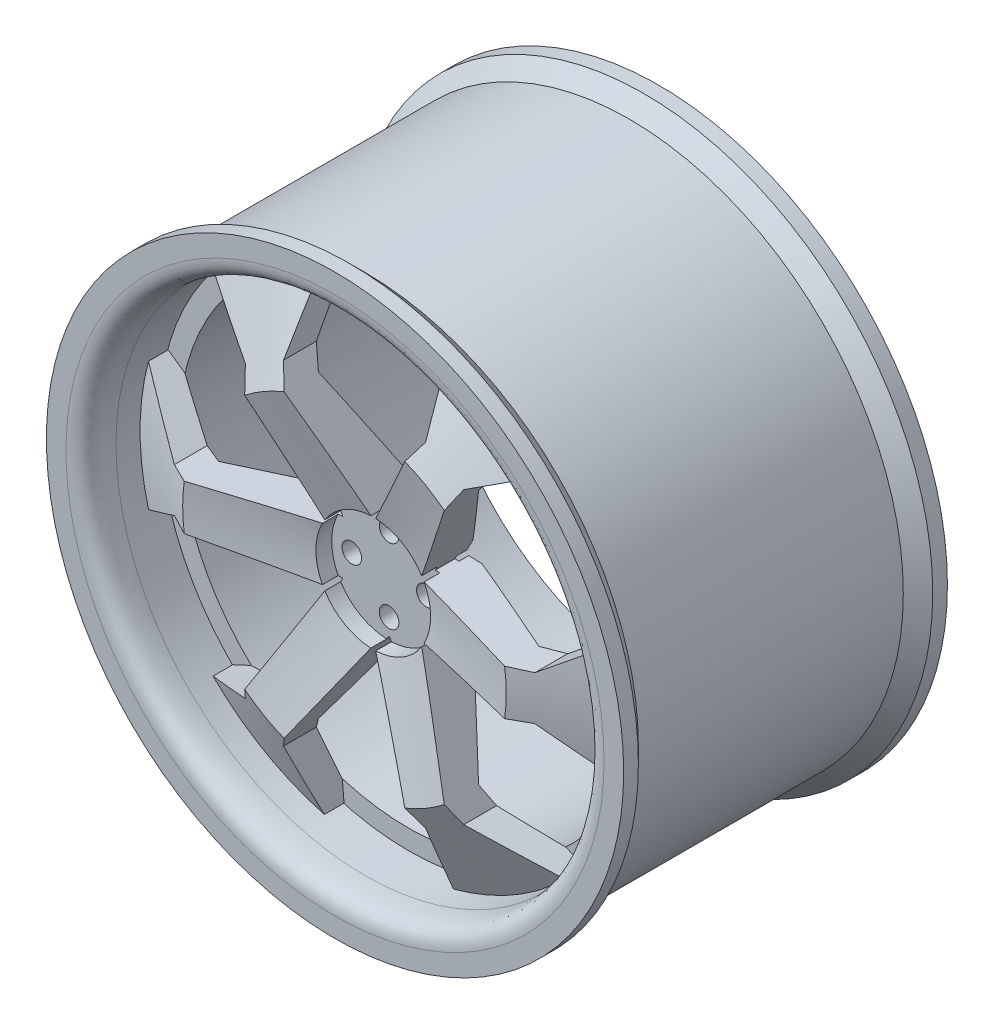
from build123d import *

# Parameters (mm, degrees)
CUT_EXTRUDE1_DEPTH = 532.389461695
CIRPATTERN1_COUNT  = 6
SKETCH4_R          = 10
CUT_EXTRUDE2_DEPTH = 484.132207579
SKETCH6_R          = 58.059555866
CUT_EXTRUDE3_DEPTH = 10
SKETCH8_R          = 58.5
CUT_EXTRUDE4_DEPTH = 220


with BuildPart() as part:
    # Sketch1 → Revolve2 (revolve)
    with BuildSketch(Plane(origin=(0, 0, 0), x_dir=(0, 0, -1), z_dir=(1, 0, 0)), mode=Mode.PRIVATE) as revolve2_sk:
        with BuildLine():
            Line((-135.1, 279.4), (135.1, 279.4))
            Line((135.1, 279.4), (150.1, 294.4))
            Line((150.1, 294.4), (165.1, 294.4))
            Line((165.1, 294.4), (165.1, 234.4))
            Line((165.1, 234.4), (0, 234.4))
            Line((0, 234.4), (-90, 234.4))
            Line((-90, 234.4), (-90, 254.4))
            Line((-90, 254.4), (-134.1, 254.4))
            add(Edge.make_bspline(
                [(-165.1, 274.4), (-165.1, 256.066666667), (-151.766666667, 254.4), (-134.1, 254.4)],
                knots=[0, 0, 0, 0, 1, 1, 1, 1], degree=3))
            Line((-165.1, 274.4), (-165.1, 294.4))
            Line((-165.1, 294.4), (-150.1, 294.4))
            Line((-150.1, 294.4), (-135.1, 279.4))
        make_face()
    revolve(revolve2_sk.sketch.rotate(Axis((0, 0, 55), (0, 0, -1)), 90), axis=Axis((0, 0, 55), (0, 0, -1)))


with BuildPart() as body_2:
    # Sketch2 → Revolve3 (revolve)
    with BuildSketch(Plane(origin=(0, 0, 0), x_dir=(0, 0, -1), z_dir=(1, 0, 0)), mode=Mode.PRIVATE) as revolve3_sk:
        Polygon((-90, 253.856917989), (-110.1, 253.856917989), (-155.5, 165), (-110, 0), (-80, 0), (-80, 70), (-120.5, 165), (-90, 234.705795499), align=None)
    revolve(revolve3_sk.sketch.rotate(Axis((0, 0, 55), (0, 0, -1)), 90), axis=Axis((0, 0, 55), (0, 0, -1)))

    # Sketch3 → Cut-Extrude1 (cut, through all)
    with BuildSketch(Plane.XY.offset(165.1)):
        with BuildLine():
            Line((-72.434950826, 170.420152916), (0, 54.5))
            Line((0, 54.5), (72.434950826, 170.420152916))
            Line((72.434950826, 170.420152916), (64, 266.832082029))
            ThreePointArc((64, 266.832082029), (0, 274.4), (-64, 266.832082029))
            Line((-64, 266.832082029), (-72.434950826, 170.420152916))
        make_face()
    cut_extrude1 = extrude(amount=-CUT_EXTRUDE1_DEPTH, mode=Mode.SUBTRACT)

    # CirPattern1: Cut-Extrude1 ×6 about axis
    cirpattern1_axis = Axis((0, 0, 0), (0, 0, 1))
    for i in range(1, CIRPATTERN1_COUNT):
        add(cut_extrude1.rotate(cirpattern1_axis, i * 360 / CIRPATTERN1_COUNT), mode=Mode.SUBTRACT)

    # Sketch4 → Cut-Extrude2 (cut, through all)
    with BuildSketch(Plane(origin=(0, 0, 80), x_dir=(-1, 0, 0), z_dir=(0, 0, -1))):
        with Locations((-38, 0)):
            Circle(SKETCH4_R)
        with Locations((0, 38)):
            Circle(SKETCH4_R)
        with Locations((38, 0)):
            Circle(SKETCH4_R)
        with Locations((0, -38)):
            Circle(SKETCH4_R)
    extrude(amount=-CUT_EXTRUDE2_DEPTH, mode=Mode.SUBTRACT)

    # Sketch6 → Cut-Extrude3 (cut)
    with BuildSketch(Plane(origin=(0, 0, 80), x_dir=(-1, 0, 0), z_dir=(0, 0, -1))):
        Circle(SKETCH6_R)
    extrude(amount=-CUT_EXTRUDE3_DEPTH, mode=Mode.SUBTRACT)

    # Sketch8 → Cut-Extrude4 (cut)
    with BuildSketch(Plane.XY.offset(330)):
        Circle(SKETCH8_R)
    extrude(amount=-CUT_EXTRUDE4_DEPTH, mode=Mode.SUBTRACT)


solid = Compound([part.part, body_2.part])
